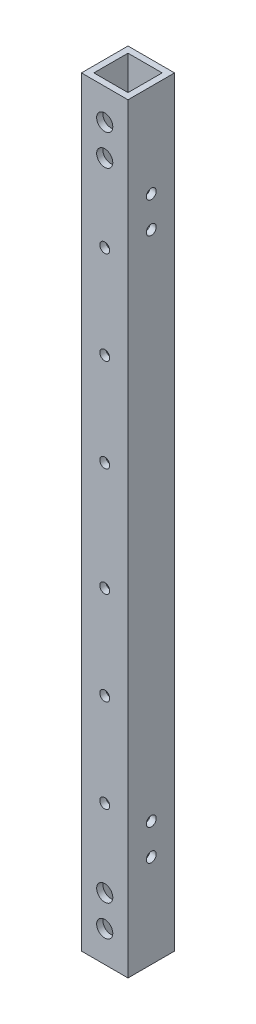
from build123d import *

# Parameters (mm, degrees)
SKETCH1_W           = 15
SKETCH1_H           = 15
SKETCH1_W_2         = 11
SKETCH1_H_2         = 11
BOSS_EXTRUDE1_DEPTH = 245
SKETCH2_R           = 1.6
CUT_EXTRUDE1_DEPTH  = 246.916652547
SKETCH4_R           = 2.6
CUT_EXTRUDE2_DEPTH  = 246.916652547
SKETCH5_R           = 1.6
CUT_EXTRUDE3_DEPTH  = 246.916652547


with BuildPart() as part:
    # Sketch1 → Boss-Extrude1 (new body)
    with BuildSketch(Plane(origin=(0, 0, 0), x_dir=(1, 0, 0), z_dir=(0, 1, 0))):
        with Locations((7.5, 7.5)):
            Rectangle(SKETCH1_W, SKETCH1_H)
        with Locations((7.5, 7.5)):
            Rectangle(SKETCH1_W_2, SKETCH1_H_2, mode=Mode.SUBTRACT)
    extrude(amount=BOSS_EXTRUDE1_DEPTH)

    # Sketch2 → Cut-Extrude1 (cut, through all)
    with BuildSketch(Plane(origin=(15, 0, 0), x_dir=(0, 0, -1), z_dir=(1, 0, 0))):
        with Locations((7.5, 215)):
            Circle(SKETCH2_R)
        with Locations((7.5, 205)):
            Circle(SKETCH2_R)
        with Locations((7.5, 30)):
            Circle(SKETCH2_R)
        with Locations((7.5, 40)):
            Circle(SKETCH2_R)
    extrude(amount=-CUT_EXTRUDE1_DEPTH, mode=Mode.SUBTRACT)

    # Sketch4 → Cut-Extrude2 (cut, through all)
    with BuildSketch(Plane(origin=(0, 0, -15), x_dir=(-1, 0, 0), z_dir=(0, 0, -1))):
        with Locations((-7.5, 235)):
            Circle(SKETCH4_R)
        with Locations((-7.5, 225)):
            Circle(SKETCH4_R)
        with Locations((-7.5, 10)):
            Circle(SKETCH4_R)
        with Locations((-7.5, 20)):
            Circle(SKETCH4_R)
    extrude(amount=-CUT_EXTRUDE2_DEPTH, mode=Mode.SUBTRACT)

    # Sketch5 → Cut-Extrude3 (cut, through all)
    with BuildSketch(Plane(origin=(0, 0, -15), x_dir=(-1, 0, 0), z_dir=(0, 0, -1))):
        with Locations((-7.5, 45)):
            Circle(SKETCH5_R)
        with Locations((-7.5, 75)):
            Circle(SKETCH5_R)
        with Locations((-7.5, 200)):
            Circle(SKETCH5_R)
        with Locations((-7.5, 170)):
            Circle(SKETCH5_R)
        with Locations((-7.5, 140)):
            Circle(SKETCH5_R)
        with Locations((-7.5, 105)):
            Circle(SKETCH5_R)
    extrude(amount=-CUT_EXTRUDE3_DEPTH, mode=Mode.SUBTRACT)


solid = part.part
